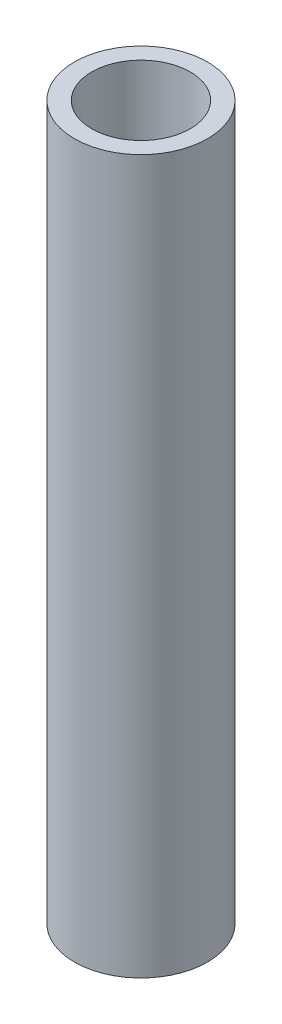
from build123d import *

# Parameters (mm, degrees)
SKETCH1_R           = 10.668
SKETCH1_R_2         = 7.8994
BOSS_EXTRUDE1_DEPTH = 114.3


with BuildPart() as part:
    # Sketch1 → Boss-Extrude1 (new body)
    with BuildSketch(Plane(origin=(0, 0, 0), x_dir=(1, 0, 0), z_dir=(0, 1, 0))):
        with Locations(Location((0, 0, 0), (0, 0, 270))):
            Circle(SKETCH1_R)
        with Locations(Location((0, 0, 0), (0, 0, 270))):
            Circle(SKETCH1_R_2, mode=Mode.SUBTRACT)
    extrude(amount=BOSS_EXTRUDE1_DEPTH)


solid = part.part
